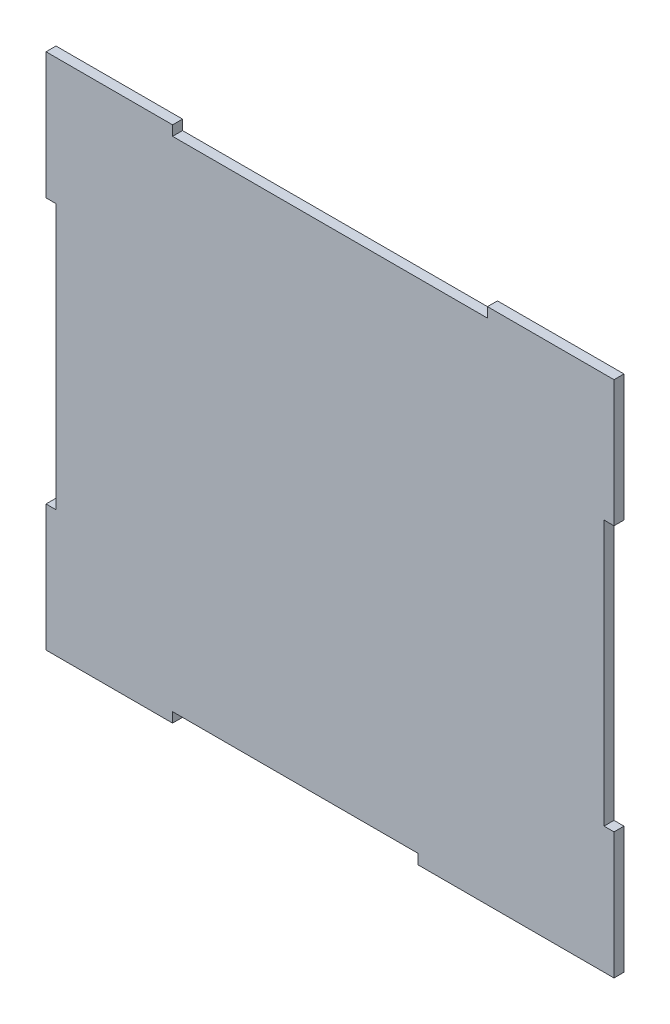
from build123d import *

# Parameters (mm, degrees)
BOSS_EXTRUDE1_DEPTH = 2


with BuildPart() as part:
    # Sketch1 → Boss-Extrude1 (new body)
    with BuildSketch(Plane.XY):
        Polygon((-52, 52), (-26.6, 52), (-26.6, 50), (36.6, 50), (36.6, 52), (62, 52), (62, 26.6), (60, 26.6), (60, -26.6), (62, -26.6), (62, -52), (22.63, -52), (22.63, -50), (-26.6, -50), (-26.6, -52), (-52, -52), (-52, -26.6), (-50, -26.6), (-50, 26.6), (-52, 26.6), align=None)
    extrude(amount=BOSS_EXTRUDE1_DEPTH)


solid = part.part
